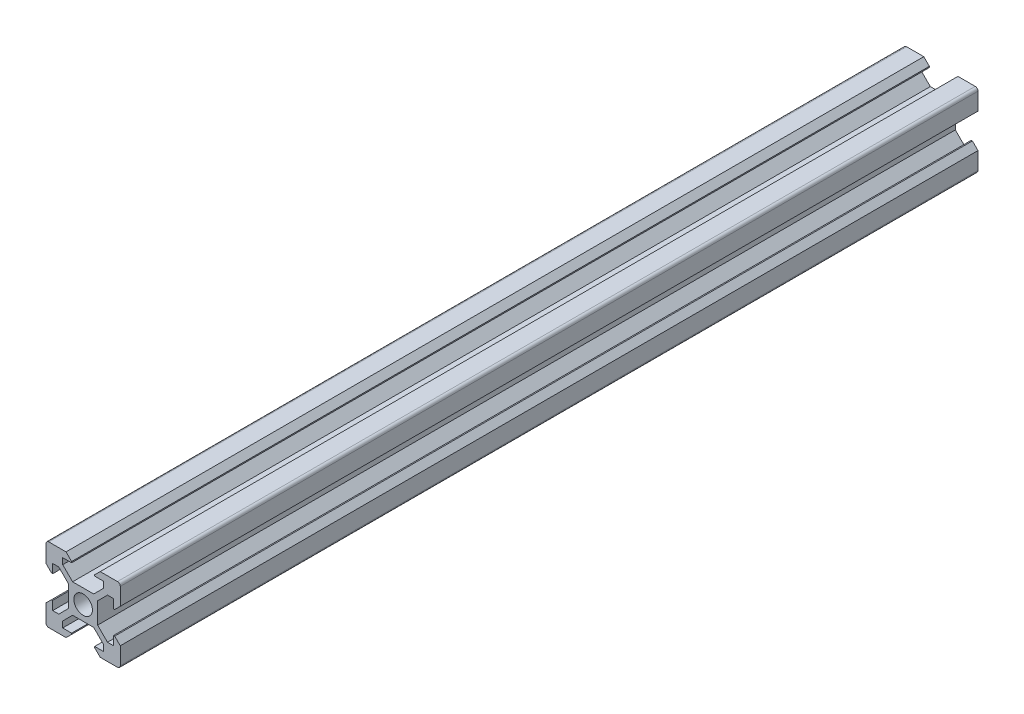
from build123d import *

# Parameters (mm, degrees)
CROQUIS1_R              = 2.5
SALIENTE_EXTRUIR1_DEPTH = 480
CUT_EXTRUDE1_DEPTH      = 25
CUT_EXTRUDE1_DEPTH_BACK = 24
SKETCH2_W               = 498
SKETCH2_H               = 26.785887704


with BuildPart() as part:
    # Croquis1 → Saliente-Extruir1 (new body)
    with BuildSketch(Plane.XY):
        with BuildLine():
            Line((-4.6, 10), (-3.1, 8.5))
            Line((-3.1, 8.5), (-3.1, 8.2))
            Line((-3.1, 8.2), (-5.5, 8.2))
            Line((-5.5, 8.2), (-5.5, 6.560660172))
            Line((-5.5, 6.560660172), (-2.84, 3.900660172))
            Line((-2.84, 3.900660172), (0, 3.900660172))
            Line((0, 3.900660172), (2.84, 3.900660172))
            Line((2.84, 3.900660172), (5.5, 6.560660172))
            Line((5.5, 6.560660172), (5.5, 8.2))
            Line((5.5, 8.2), (3.1, 8.2))
            Line((3.1, 8.2), (3.1, 8.5))
            Line((3.1, 8.5), (4.6, 10))
            Line((4.6, 10), (9.25, 10))
            ThreePointArc((9.25, 10), (9.780330086, 9.780330086), (10, 9.25))
            Line((10, 9.25), (10, 4.6))
            Line((10, 4.6), (8.5, 3.1))
            Line((8.5, 3.1), (8.2, 3.1))
            Line((8.2, 3.1), (8.2, 5.5))
            Line((8.2, 5.5), (6.560660172, 5.5))
            Line((6.560660172, 5.5), (3.900660172, 2.84))
            Line((3.900660172, 2.84), (3.900660172, 0))
            Line((3.900660172, 0), (3.900660172, -2.84))
            Line((3.900660172, -2.84), (6.560660172, -5.5))
            Line((6.560660172, -5.5), (8.2, -5.5))
            Line((8.2, -5.5), (8.2, -3.1))
            Line((8.2, -3.1), (8.5, -3.1))
            Line((8.5, -3.1), (10, -4.6))
            Line((10, -4.6), (10, -9.25))
            ThreePointArc((10, -9.25), (9.780330086, -9.780330086), (9.25, -10))
            Line((9.25, -10), (4.6, -10))
            Line((4.6, -10), (3.1, -8.5))
            Line((3.1, -8.5), (3.1, -8.2))
            Line((3.1, -8.2), (5.5, -8.2))
            Line((5.5, -8.2), (5.5, -6.560660172))
            Line((5.5, -6.560660172), (2.84, -3.900660172))
            Line((2.84, -3.900660172), (0, -3.900660172))
            Line((0, -3.900660172), (-2.84, -3.900660172))
            Line((-2.84, -3.900660172), (-5.5, -6.560660172))
            Line((-5.5, -6.560660172), (-5.5, -8.2))
            Line((-5.5, -8.2), (-3.1, -8.2))
            Line((-3.1, -8.2), (-3.1, -8.5))
            Line((-3.1, -8.5), (-4.6, -10))
            Line((-4.6, -10), (-9.25, -10))
            ThreePointArc((-9.25, -10), (-9.780330086, -9.780330086), (-10, -9.25))
            Line((-10, -9.25), (-10, -4.6))
            Line((-10, -4.6), (-8.5, -3.1))
            Line((-8.5, -3.1), (-8.2, -3.1))
            Line((-8.2, -3.1), (-8.2, -5.5))
            Line((-8.2, -5.5), (-6.560660172, -5.5))
            Line((-6.560660172, -5.5), (-3.900660172, -2.84))
            Line((-3.900660172, -2.84), (-3.900660172, 0))
            Line((-3.900660172, 0), (-3.900660172, 2.84))
            Line((-3.900660172, 2.84), (-6.560660172, 5.5))
            Line((-6.560660172, 5.5), (-8.2, 5.5))
            Line((-8.2, 5.5), (-8.2, 3.1))
            Line((-8.2, 3.1), (-8.5, 3.1))
            Line((-8.5, 3.1), (-10, 4.6))
            Line((-10, 4.6), (-10, 9.25))
            ThreePointArc((-10, 9.25), (-9.780330086, 9.780330086), (-9.25, 10))
            Line((-9.25, 10), (-4.6, 10))
        make_face()
        Circle(CROQUIS1_R, mode=Mode.SUBTRACT)
    extrude(amount=SALIENTE_EXTRUIR1_DEPTH)

    # Sketch2 → Cut-Extrude1 (cut, two sides: drawn at the far end of the back side and taken through both)
    with BuildSketch(Plane(origin=(0, 0, 0), x_dir=(0, 0, -1), z_dir=(1, 0, 0)).offset(-CUT_EXTRUDE1_DEPTH_BACK)):
        Rectangle(SKETCH2_W, SKETCH2_H)
    extrude(amount=CUT_EXTRUDE1_DEPTH + CUT_EXTRUDE1_DEPTH_BACK, mode=Mode.SUBTRACT)


solid = part.part
